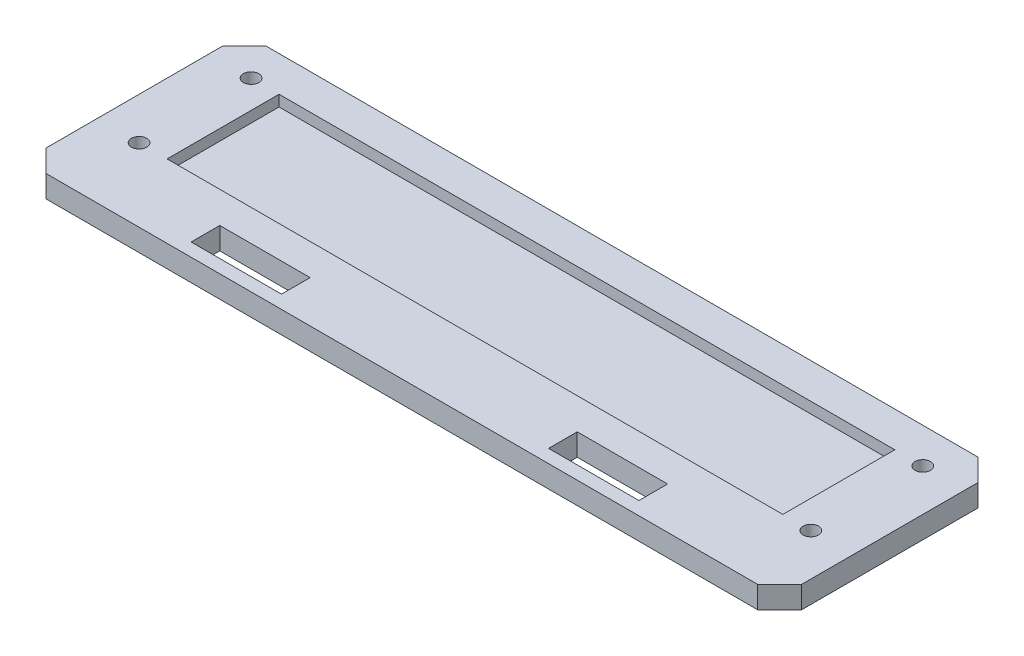
from build123d import *

# Parameters (mm, degrees)
SKETCH1_W           = 171.45
SKETCH1_H           = 50
SKETCH1_R           = 1.75
BOSS_EXTRUDE1_DEPTH = 5
CHAMFER1_SIZE       = 5
SKETCH2_W           = 139.7
SKETCH2_H           = 25.4
CUT_EXTRUDE1_DEPTH  = 2.5
SKETCH3_W           = 20.5
SKETCH3_H           = 6.5
CUT_EXTRUDE2_DEPTH  = 15


with BuildPart() as part:
    # Sketch1 → Boss-Extrude1 (new body)
    with BuildSketch(Plane(origin=(0, 0, 0), x_dir=(1, 0, 0), z_dir=(0, 1, 0))):
        Rectangle(SKETCH1_W, SKETCH1_H)
        with Locations(Location((-76.2, 17, 0), (0, 0, 270))):
            Circle(SKETCH1_R, mode=Mode.SUBTRACT)
        with Locations(Location((76.2, 17, 0), (0, 0, 270))):
            Circle(SKETCH1_R, mode=Mode.SUBTRACT)
        with Locations(Location((-76.2, -8.4, 0), (0, 0, 270))):
            Circle(SKETCH1_R, mode=Mode.SUBTRACT)
        with Locations(Location((76.2, -8.4, 0), (0, 0, 270))):
            Circle(SKETCH1_R, mode=Mode.SUBTRACT)
    extrude(amount=BOSS_EXTRUDE1_DEPTH)

    # Chamfer1
    chamfer1_edges = [part.edges().sort_by_distance(p)[0] for p in [
        (85.725, 2.5, 25),
        (-85.725, 2.5, 25),
        (-85.725, 2.5, -25),
        (85.725, 2.5, -25),
    ]]
    chamfer(chamfer1_edges, length=CHAMFER1_SIZE)

    # Sketch2 → Cut-Extrude1 (cut)
    with BuildSketch(Plane(origin=(0, 5, 0), x_dir=(1, 0, 0), z_dir=(0, 1, 0))):
        with Locations((0, 4.3)):
            Rectangle(SKETCH2_W, SKETCH2_H)
    extrude(amount=-CUT_EXTRUDE1_DEPTH, mode=Mode.SUBTRACT)

    # Sketch3 → Cut-Extrude2 (cut)
    with BuildSketch(Plane(origin=(0, 5, 0), x_dir=(1, 0, 0), z_dir=(0, 1, 0))):
        with Locations((40.55, -18.75)):
            Rectangle(SKETCH3_W, SKETCH3_H)
        with Locations((-40.55, -18.75)):
            Rectangle(SKETCH3_W, SKETCH3_H)
    extrude(amount=-CUT_EXTRUDE2_DEPTH, mode=Mode.SUBTRACT)


solid = part.part
